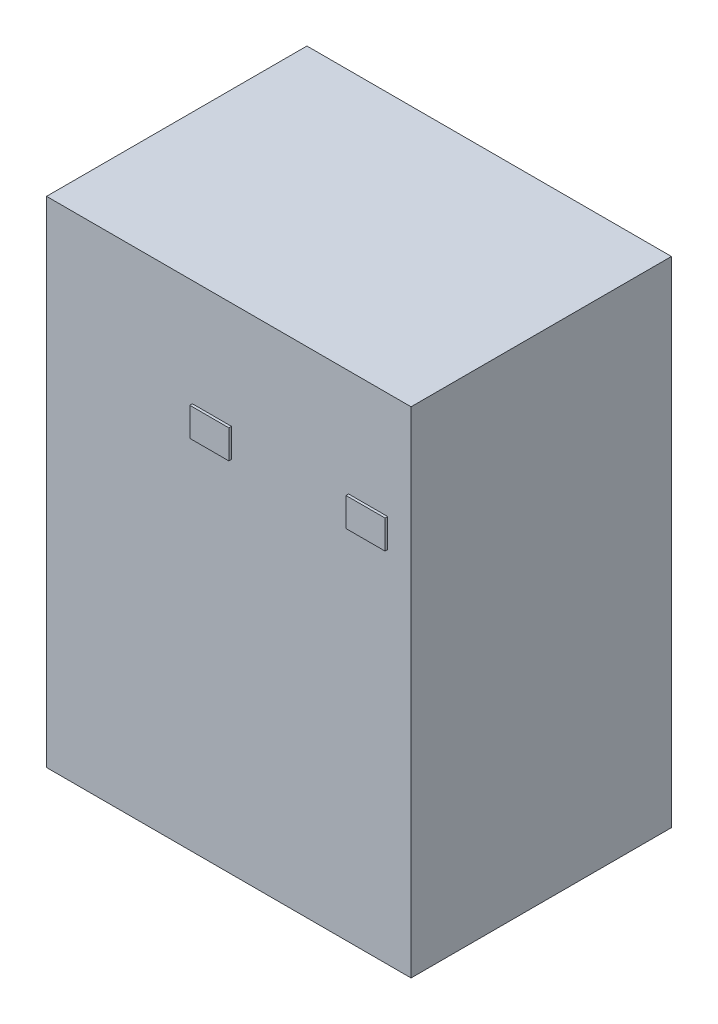
from build123d import *

# Parameters (mm, degrees)
SKETCH1_W           = 140
SKETCH1_H           = 190
BOSS_EXTRUDE1_DEPTH = 100
SKETCH2_W           = 15
SKETCH2_H           = 11
BOSS_EXTRUDE2_DEPTH = 1


with BuildPart() as part:
    # Sketch1 → Boss-Extrude1 (new body)
    with BuildSketch(Plane.XY):
        with Locations((70, -95)):
            Rectangle(SKETCH1_W, SKETCH1_H)
    extrude(amount=BOSS_EXTRUDE1_DEPTH)

    # Sketch2 → Boss-Extrude2 (add)
    with BuildSketch(Plane.XY.offset(100)):
        with Locations((123.5, -46.5)):
            Rectangle(SKETCH2_W, SKETCH2_H)
        with Locations((63.5, -46.5)):
            Rectangle(SKETCH2_W, SKETCH2_H)
    extrude(amount=BOSS_EXTRUDE2_DEPTH)


solid = part.part
